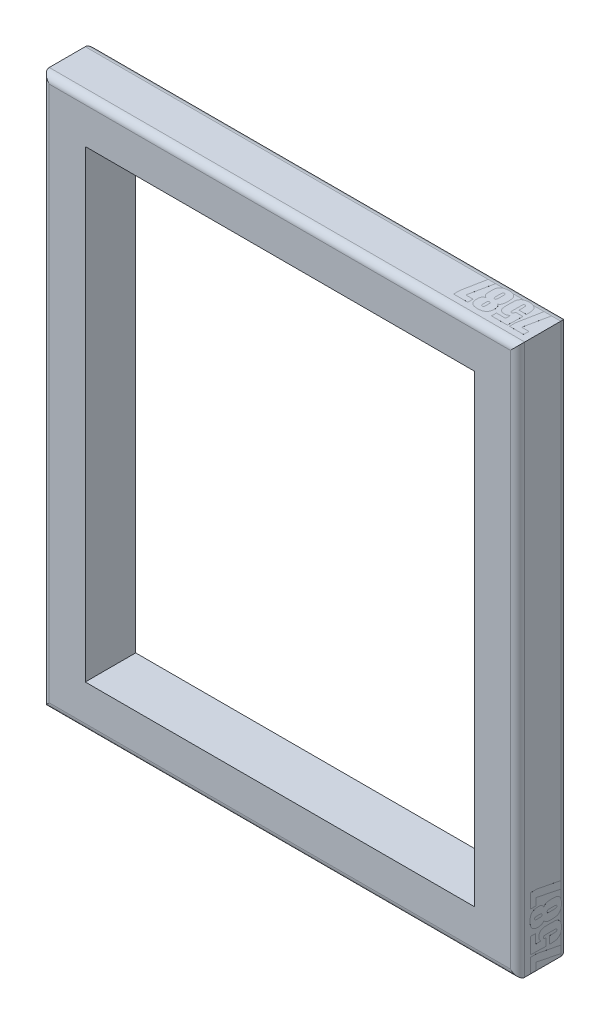
from build123d import *

# Parameters (mm, degrees)
SKETCH1_W           = 838.2
SKETCH1_H           = 969.899
SKETCH1_W_2         = 685.8
SKETCH1_H_2         = 817.499
BOSS_EXTRUDE1_DEPTH = 88.9
FILLET1_R           = 12.7
BOSS_EXTRUDE4_DEPTH = 0.0254
BOSS_EXTRUDE6_DEPTH = 0.0254
BOSS_EXTRUDE7_DEPTH = 0.0254
BOSS_EXTRUDE8_DEPTH = 0.0254


with BuildPart() as part:
    # Sketch1 → Boss-Extrude1 (new body)
    with BuildSketch(Plane.XY):
        with Locations((-393.7, 408.7495)):
            Rectangle(SKETCH1_W, SKETCH1_H)
        with Locations((-393.7, 408.7495)):
            Rectangle(SKETCH1_W_2, SKETCH1_H_2, mode=Mode.SUBTRACT)
    extrude(amount=-BOSS_EXTRUDE1_DEPTH)

    # Fillet1
    fillet1_edges = [part.edges().sort_by_distance(p)[0] for p in [
        (-812.8, 408.7495, -88.9),
        (-393.7, -76.2, -88.9),
        (25.4, 408.7495, -88.9),
        (-393.7, -76.2, 0),
        (-812.8, 408.7495, 0),
        (-393.7, 893.699, 0),
        (25.4, 408.7495, 0),
        (-393.7, 893.699, -88.9),
    ]]
    fillet(fillet1_edges, radius=FILLET1_R)

    # Sketch6 → Boss-Extrude4 (add)
    # profile 1 of 4: a face of its own
    with BuildSketch(Plane.XZ.offset(76.2)):
        Polygon((-775.397206265, -23.212708876), (-775.397206265, -34.277702022), (-783.501144908, -76.2), (-796.592122715, -76.2), (-787.553114229, -32.56340731), (-800.332402089, -32.56340731), (-800.332402089, -23.212708876), align=None)
    # profile 2 of 4: a face of its own
    with BuildSketch(Plane.XZ.offset(76.2)):
        with BuildLine():
            Line((-743.604831591, -23.212708876), (-743.604831591, -31.940027414))
            Line((-743.604831591, -31.940027414), (-759.812708876, -31.940027414))
            Line((-759.812708876, -31.940027414), (-759.812708876, -41.20306305))
            add(Edge.make_bspline(
                [(-759.812708876, -41.20306305), (-759.555977375, -40.911161607), (-759.05289104, -40.339156897), (-758.203287973, -39.59948061), (-757.31688462, -38.950610996), (-756.352540612, -38.449686845), (-755.344439189, -38.047478435), (-754.284990342, -37.748811018), (-753.165177285, -37.585699612), (-752.40083068, -37.562359109), (-752.01071987, -37.550446474)],
                knots=[0, 0, 0, 0, 1.045137506, 2.048032268, 3.025244095, 3.994689253, 4.963425262, 5.942900511, 6.950087905, 8, 8, 8, 8], degree=3))
            add(Edge.make_bspline(
                [(-752.01071987, -37.550446474), (-751.5753946, -37.560572296), (-750.728501027, -37.580271344), (-749.497473757, -37.710161958), (-748.352134752, -37.959944885), (-747.283944753, -38.283288733), (-746.304722065, -38.719671226), (-745.395639036, -39.230451526), (-744.588349742, -39.866074338), (-743.836345836, -40.580764758), (-743.183903273, -41.452215936), (-742.617057693, -42.483166997), (-742.159128138, -43.696673794), (-741.77022763, -45.074712041), (-741.473512713, -46.629495222), (-741.268166909, -48.357810092), (-741.125354909, -50.259181789), (-741.116125032, -51.5859422), (-741.111312009, -52.277796507)],
                knots=[0, 0, 0, 0, 0.985872992, 1.917944025, 2.797562931, 3.637028488, 4.440265023, 5.220874469, 5.991447987, 6.760933446, 7.563799771, 8.445720104, 9.41645382, 10.49401341, 11.685015475, 12.996358654, 14.433717056, 16, 16, 16, 16], degree=3))
            Line((-741.111312009, -52.277796507), (-741.111312009, -59.787576187))
            add(Edge.make_bspline(
                [(-741.111312009, -59.787576187), (-741.114314059, -60.238869043), (-741.120102449, -61.109027139), (-741.132437229, -62.369251199), (-741.18586531, -63.534721041), (-741.245170034, -64.609302477), (-741.304170666, -65.591480595), (-741.408615106, -66.480132886), (-741.509134218, -67.277361296), (-741.677117644, -68.21229513), (-741.961013415, -69.299467562), (-742.455270802, -70.542019338), (-743.103274578, -71.734601638), (-743.897310805, -72.873428682), (-744.855086628, -73.928491163), (-745.99965081, -74.845926401), (-747.309829524, -75.63960778), (-748.787634854, -76.301622987), (-750.439137733, -76.816037958), (-752.260627054, -77.179374827), (-754.251892978, -77.404169059), (-755.636736722, -77.432215352), (-756.354898518, -77.446759791)],
                knots=[0, 0, 0, 0, 0.989754807, 1.908390848, 2.7635747, 3.547977914, 4.268858805, 4.920711554, 5.509810583, 6.030765573, 7.003130656, 7.968352344, 8.956004724, 9.973318671, 11.006457242, 12.069562088, 13.178372901, 14.357538766, 15.611873537, 16.963616047, 18.425371121, 20, 20, 20, 20], degree=3))
            add(Edge.make_bspline(
                [(-756.354898518, -77.446759791), (-757.167673364, -77.423696733), (-758.751523705, -77.378753864), (-761.05612293, -77.047243869), (-763.212671595, -76.481238427), (-764.895167638, -75.823258393), (-766.14184118, -75.184766025), (-767.002125828, -74.651314239), (-767.786123641, -74.048742685), (-768.508077965, -73.401879218), (-769.151305518, -72.690376618), (-769.747123523, -71.942274062), (-770.247032282, -71.118609389), (-770.694605848, -70.238104289), (-771.081180372, -69.268096101), (-771.39116018, -68.181756329), (-771.680128414, -66.981343604), (-771.89630434, -65.652363449), (-772.069495514, -64.202944467), (-772.19718483, -62.633737406), (-772.259396094, -60.943929123), (-772.273171852, -59.777875526), (-772.280306787, -59.173936602)],
                knots=[0, 0, 0, 0, 1.727950145, 3.367247941, 4.937991842, 6.459754912, 7.197724692, 7.914163588, 8.608713051, 9.29788901, 9.972208411, 10.646138941, 11.328189198, 12.016707826, 12.744892405, 13.544369189, 14.416825977, 15.369082158, 16.405235107, 17.52037283, 18.715716525, 20, 20, 20, 20], degree=3))
            Line((-772.280306787, -59.173936602), (-772.280306787, -56.251843342))
            Line((-772.280306787, -56.251843342), (-759.18932898, -56.251843342))
            Line((-759.18932898, -56.251843342), (-759.18932898, -59.641471524))
            add(Edge.make_bspline(
                [(-759.18932898, -59.641471524), (-759.185620671, -60.063543871), (-759.178460766, -60.878469966), (-759.175578588, -62.05402751), (-759.143093775, -63.135195908), (-759.105722103, -64.1191072), (-759.057462951, -65.005613589), (-759.000320479, -65.798151324), (-758.931134266, -66.496217071), (-758.862522052, -67.107009795), (-758.747097607, -67.634534221), (-758.58241763, -68.088113051), (-758.368492845, -68.478355815), (-758.090365421, -68.79894568), (-757.75425622, -69.040832504), (-757.374015527, -69.226510605), (-756.933682995, -69.317704752), (-756.624701065, -69.334159029), (-756.462041937, -69.342821149)],
                knots=[0, 0, 0, 0, 1.823732709, 3.521214749, 5.07892445, 6.496893277, 7.775393918, 8.9147992, 9.929598955, 10.806563962, 11.568882902, 12.256841855, 12.884990135, 13.481481553, 14.073502327, 14.663358483, 15.296344146, 16, 16, 16, 16], degree=3))
            add(Edge.make_bspline(
                [(-756.462041937, -69.342821149), (-756.311814224, -69.335904639), (-756.019469637, -69.322445045), (-755.609150798, -69.202677213), (-755.238890611, -69.013447494), (-754.844055704, -68.652305625), (-754.463702156, -68.127802624), (-754.304731396, -67.549210427), (-754.301321899, -67.089367955), (-754.273196809, -66.687313598), (-754.270968077, -66.134958148), (-754.261914861, -65.433646231), (-754.235937401, -64.583189124), (-754.235071306, -63.582957594), (-754.2071631, -62.437042159), (-754.203977638, -61.622021218), (-754.202289816, -61.190180952)],
                knots=[0, 0, 0, 0, 0.670460052, 1.304721758, 1.895793995, 2.513210904, 3.681360763, 4.748587252, 5.126397419, 5.736946296, 6.550219692, 7.595791071, 8.873918375, 10.355072828, 12.068728984, 14, 14, 14, 14], degree=3))
            Line((-754.202289816, -61.190180952), (-754.202289816, -50.758308012))
            add(Edge.make_bspline(
                [(-754.202289816, -50.758308012), (-754.209495191, -50.303588843), (-754.222695071, -49.470566535), (-754.319979118, -48.338076136), (-754.493400248, -47.438533211), (-754.749555135, -46.745585738), (-755.122962603, -46.249037086), (-755.575763802, -45.884057111), (-756.149429362, -45.690937481), (-756.558153995, -45.667007013), (-756.773731885, -45.654385117)],
                knots=[0, 0, 0, 0, 1.685864163, 3.088417099, 4.207402662, 5.076902269, 5.799120759, 6.485333904, 7.201103886, 8, 8, 8, 8], degree=3))
            add(Edge.make_bspline(
                [(-756.773731885, -45.654385117), (-756.913880725, -45.659095977), (-757.188087064, -45.668312949), (-757.582646896, -45.7669057), (-757.939269015, -45.938230081), (-758.352480278, -46.22605672), (-758.7466933, -46.66636358), (-759.030906314, -47.194645083), (-759.101551428, -47.734734037), (-759.164457035, -48.321253834), (-759.18302364, -49.105777274), (-759.187085498, -49.693453639), (-759.18932898, -50.018044386)],
                knots=[0, 0, 0, 0, 0.735055358, 1.438162732, 2.117072139, 2.803012647, 4.070557493, 5.191645157, 5.884125613, 6.912400264, 8.294628872, 10, 10, 10, 10], degree=3))
            Line((-759.18932898, -50.018044386), (-772.280306787, -50.018044386))
            Line((-772.280306787, -50.018044386), (-771.656926892, -23.212708876))
            Line((-771.656926892, -23.212708876), (-743.604831591, -23.212708876))
        make_face()
    # profile 3 of 4: a face of its own
    with BuildSketch(Plane.XZ.offset(76.2)):
        with BuildLine():
            add(Edge.make_bspline(
                [(-710.692321167, -46.58945496), (-710.253487376, -46.794102682), (-709.389538795, -47.197000345), (-708.235364294, -48.012376105), (-707.249912338, -48.978472514), (-706.523152283, -49.897517746), (-706.051202939, -50.811292425), (-705.762743279, -51.706861748), (-705.51589336, -52.796404663), (-705.301551238, -54.080522928), (-705.156204486, -55.567900372), (-705.041655919, -57.253698057), (-704.959553092, -59.140684774), (-704.956748525, -60.466056129), (-704.955278065, -61.160960019)],
                knots=[0, 0, 0, 0, 1.032863208, 2.033436625, 2.999672589, 3.9748283, 4.520758756, 5.187511175, 5.978195588, 6.906317789, 7.966347498, 9.169082625, 10.515725053, 12, 12, 12, 12], degree=3))
            add(Edge.make_bspline(
                [(-704.955278065, -61.160960019), (-704.958814763, -61.674005032), (-704.965666773, -62.667980084), (-705.023698386, -64.103820002), (-705.120085308, -65.435815896), (-705.253802708, -66.66448171), (-705.42938603, -67.788315856), (-705.628046142, -68.812038252), (-705.879907395, -69.726796939), (-706.176510337, -70.550492599), (-706.518720915, -71.309018255), (-706.946029104, -72.011170672), (-707.430230635, -72.689024305), (-708.003004831, -73.320562442), (-708.638355668, -73.929374639), (-709.349659441, -74.501289288), (-710.133300581, -75.04017453), (-710.989805449, -75.534912741), (-711.923071811, -75.986497091), (-712.931173784, -76.384062017), (-714.015916849, -76.715170959), (-715.176538596, -76.974211096), (-716.408193527, -77.188055959), (-717.718139511, -77.344956513), (-719.103536316, -77.430364051), (-720.052646646, -77.441198853), (-720.539775455, -77.446759791)],
                knots=[0, 0, 0, 0, 1.398583789, 2.709620715, 3.916618244, 5.038718275, 6.077731848, 7.016823425, 7.880065367, 8.661220812, 9.401808779, 10.144087346, 10.898301765, 11.669363034, 12.464435054, 13.295212249, 14.15449737, 15.054744736, 15.988985256, 16.978448116, 18.005975078, 19.077395418, 20.218224661, 21.412695174, 22.672071436, 24, 24, 24, 24], degree=3))
            add(Edge.make_bspline(
                [(-720.539775455, -77.446759791), (-721.013954922, -77.441503254), (-721.93718878, -77.431268704), (-723.28284111, -77.341861974), (-724.551441867, -77.199808417), (-725.743148784, -76.99043543), (-726.866555879, -76.747615488), (-727.907622999, -76.419394986), (-728.880842673, -76.05687962), (-729.769055527, -75.612817835), (-730.586703699, -75.12200953), (-731.351457247, -74.606583761), (-732.058624654, -74.050674339), (-732.694411171, -73.448412652), (-733.280015525, -72.816393903), (-733.80680854, -72.148745446), (-734.260650581, -71.432964934), (-734.677334577, -70.678366318), (-735.017688554, -69.829695849), (-735.31940769, -68.873086589), (-735.569168259, -67.788127109), (-735.767979966, -66.577220491), (-735.935428241, -65.238877596), (-736.047194349, -63.772964785), (-736.116516416, -62.181130169), (-736.121622822, -61.079869578), (-736.124272844, -60.508359191)],
                knots=[0, 0, 0, 0, 1.268974087, 2.470709768, 3.607874871, 4.683617739, 5.708163252, 6.681184595, 7.602668945, 8.484841014, 9.334307608, 10.153776327, 10.951769698, 11.738661753, 12.495071084, 13.256455536, 14.010915677, 14.761311323, 15.560108623, 16.453296839, 17.443968622, 18.536843119, 19.736471951, 21.052764021, 22.470501904, 24, 24, 24, 24], degree=3))
            add(Edge.make_bspline(
                [(-736.124272844, -60.508359191), (-736.11912778, -59.738645817), (-736.109176065, -58.249846521), (-735.967151758, -56.095256859), (-735.754514227, -54.09961998), (-735.520886163, -52.531610578), (-735.226436538, -51.36034273), (-734.912756596, -50.540142343), (-734.512646973, -49.762291945), (-734.008144846, -49.035614416), (-733.409580802, -48.353894585), (-732.725947764, -47.710146664), (-731.952178901, -47.108489834), (-731.381373835, -46.765447118), (-731.088532125, -46.58945496)],
                knots=[0, 0, 0, 0, 1.76788096, 3.419480574, 4.957221844, 6.378326448, 7.056708483, 7.727130868, 8.390966019, 9.061263932, 9.753766915, 10.471320765, 11.215737443, 12, 12, 12, 12], degree=3))
            add(Edge.make_bspline(
                [(-731.088532125, -46.58945496), (-731.49093332, -46.373423135), (-732.290000875, -45.944438271), (-733.320895239, -45.042456456), (-734.198533639, -43.976346239), (-734.918397885, -42.730124608), (-735.453741877, -41.298912841), (-735.855258326, -39.699046673), (-736.082931276, -37.920597805), (-736.110123233, -36.677708203), (-736.124272844, -36.030957979)],
                knots=[0, 0, 0, 0, 0.883452064, 1.754313577, 2.635585967, 3.552582121, 4.531408869, 5.589827807, 6.745842426, 8, 8, 8, 8], degree=3))
            add(Edge.make_bspline(
                [(-736.124272844, -36.030957979), (-736.11485617, -35.462195026), (-736.096614336, -34.360396344), (-735.904533962, -32.761034378), (-735.608268676, -31.270623142), (-735.194430392, -29.885805214), (-734.639828046, -28.619081076), (-733.983074979, -27.450393201), (-733.183446758, -26.402041154), (-732.27111657, -25.456629554), (-731.233035533, -24.626176928), (-730.072238941, -23.913095828), (-728.79773282, -23.309201617), (-727.405857517, -22.809058021), (-725.890159765, -22.436201844), (-724.258687175, -22.166298974), (-722.507538248, -21.998721399), (-721.299906789, -21.977111204), (-720.676139807, -21.965949085)],
                knots=[0, 0, 0, 0, 1.139402086, 2.207231867, 3.22303984, 4.18224988, 5.097340406, 5.98918555, 6.862439802, 7.732171629, 8.616292135, 9.519178424, 10.456373729, 11.438161639, 12.478190297, 13.58003508, 14.750037352, 16, 16, 16, 16], degree=3))
            add(Edge.make_bspline(
                [(-720.676139807, -21.965949085), (-719.961453663, -21.976152166), (-718.588200433, -21.995757157), (-716.612677728, -22.17235312), (-714.807341552, -22.457355795), (-713.172230372, -22.86237432), (-711.709311377, -23.384193826), (-710.419058513, -24.029851148), (-709.293602942, -24.788153544), (-708.345979101, -25.683184673), (-707.543951702, -26.681096088), (-706.847406171, -27.768477757), (-706.262700087, -28.959641298), (-705.773231955, -30.245907568), (-705.406660699, -31.637792434), (-705.150145582, -33.124115808), (-704.975290585, -34.708627918), (-704.962082349, -35.79993614), (-704.955278065, -36.362128548)],
                knots=[0, 0, 0, 0, 1.390282688, 2.671396681, 3.855329736, 4.943140366, 5.94429892, 6.870936351, 7.743522199, 8.574793464, 9.396625976, 10.229000645, 11.082185822, 11.973862168, 12.902457006, 13.877689888, 14.906682267, 16, 16, 16, 16], degree=3))
            add(Edge.make_bspline(
                [(-704.955278065, -36.362128548), (-704.959749129, -36.716069238), (-704.968408444, -37.401562372), (-705.013729812, -38.389707737), (-705.100472887, -39.303374453), (-705.226410501, -40.135369978), (-705.380348808, -40.894415369), (-705.571590454, -41.576659915), (-705.805898379, -42.181958593), (-706.165520964, -42.913806345), (-706.810610016, -43.768744031), (-707.8379621, -44.731094828), (-709.147119296, -45.699111995), (-710.15307968, -46.278744837), (-710.692321167, -46.58945496)],
                knots=[0, 0, 0, 0, 1.011071591, 1.958188627, 2.824730267, 3.631383318, 4.36076049, 5.035941548, 5.65252725, 6.212453826, 7.360711157, 8.68567436, 10.223367527, 12, 12, 12, 12], degree=3))
        make_face()
        with BuildLine():
            add(Edge.make_bspline(
                [(-718.046255872, -34.638093525), (-718.050069251, -34.215848653), (-718.057034173, -33.444642203), (-718.146684482, -32.403735528), (-718.299876045, -31.592436044), (-718.527019522, -30.98155937), (-718.879626957, -30.551996084), (-719.341464355, -30.259006447), (-719.925930979, -30.099881266), (-720.350504889, -30.080373971), (-720.578736698, -30.069887727)],
                knots=[0, 0, 0, 0, 1.677591877, 3.064026972, 4.144413779, 4.954209473, 5.623204291, 6.313866106, 7.09361037, 8, 8, 8, 8], degree=3))
            add(Edge.make_bspline(
                [(-720.578736698, -30.069887727), (-720.80114805, -30.07813553), (-721.216228387, -30.093528182), (-721.782430055, -30.282381675), (-722.235617987, -30.593032725), (-722.56830823, -31.052628019), (-722.786265025, -31.675067746), (-722.927193684, -32.479940593), (-723.024100019, -33.489713219), (-723.030043198, -34.231966187), (-723.033295037, -34.638093525)],
                knots=[0, 0, 0, 0, 0.893586732, 1.667676933, 2.372236962, 3.073872481, 3.915008431, 5.008641075, 6.36326335, 8, 8, 8, 8], degree=3))
            Line((-723.033295037, -34.638093525), (-723.033295037, -38.797206265))
            add(Edge.make_bspline(
                [(-723.033295037, -38.797206265), (-723.026423869, -39.177380053), (-723.013764603, -39.877802598), (-722.911013987, -40.83397162), (-722.749541266, -41.605461104), (-722.498782367, -42.206501342), (-722.133817264, -42.642542693), (-721.680139916, -42.959242866), (-721.116208396, -43.131031073), (-720.712937232, -43.150581758), (-720.500814211, -43.160865534)],
                knots=[0, 0, 0, 0, 1.580112676, 2.911159526, 3.99162225, 4.849527291, 5.587451052, 6.3250044, 7.118942395, 8, 8, 8, 8], degree=3))
            add(Edge.make_bspline(
                [(-720.500814211, -43.160865534), (-720.27848227, -43.151914515), (-719.86457175, -43.135250598), (-719.301851642, -42.956797327), (-718.842259039, -42.668595802), (-718.506805208, -42.212621467), (-718.290798872, -41.575176113), (-718.15070244, -40.727966927), (-718.055128914, -39.640204651), (-718.049409829, -38.83317384), (-718.046255872, -38.388113209)],
                knots=[0, 0, 0, 0, 0.861738235, 1.604279261, 2.26950699, 2.936050938, 3.759007418, 4.863263716, 6.270155474, 8, 8, 8, 8], degree=3))
            Line((-718.046255872, -38.388113209), (-718.046255872, -34.638093525))
        make_face(mode=Mode.SUBTRACT)
        with BuildLine():
            add(Edge.make_bspline(
                [(-718.046255872, -56.972626346), (-718.051650062, -56.504657885), (-718.061485576, -55.651386075), (-718.177335018, -54.501977875), (-718.338998371, -53.596117351), (-718.615462257, -52.922809224), (-718.983107683, -52.439210606), (-719.447128036, -52.115529202), (-719.997645124, -51.911559219), (-720.398259773, -51.896215562), (-720.607957631, -51.888184072)],
                knots=[0, 0, 0, 0, 1.738659472, 3.170190386, 4.292187352, 5.146388336, 5.851388248, 6.517831636, 7.224173325, 8, 8, 8, 8], degree=3))
            add(Edge.make_bspline(
                [(-720.607957631, -51.888184072), (-720.811070464, -51.896599966), (-721.194708044, -51.912495824), (-721.723050165, -52.107330947), (-722.161231547, -52.420202549), (-722.517823672, -52.884607234), (-722.752612253, -53.557212561), (-722.915515993, -54.458975986), (-723.013843501, -55.6264714), (-723.026395973, -56.495172595), (-723.033295037, -56.972626346)],
                knots=[0, 0, 0, 0, 0.760444209, 1.436319754, 2.083469305, 2.762315263, 3.601134717, 4.733605304, 6.204730916, 8, 8, 8, 8], degree=3))
            Line((-723.033295037, -56.972626346), (-723.033295037, -63.897987373))
            add(Edge.make_bspline(
                [(-723.033295037, -63.897987373), (-723.031638696, -64.173996507), (-723.028480872, -64.700209827), (-722.999229458, -65.450525857), (-722.953024741, -66.123390099), (-722.883160131, -66.720891139), (-722.805771588, -67.244546297), (-722.680622548, -67.686884709), (-722.565238426, -68.057860706), (-722.370496587, -68.435558786), (-722.058250663, -68.805624502), (-721.589496558, -69.123064419), (-721.028223384, -69.318121442), (-720.625873758, -69.334278767), (-720.413151413, -69.342821149)],
                knots=[0, 0, 0, 0, 1.447752538, 2.760150215, 3.93838463, 4.984106116, 5.916477053, 6.709663222, 7.393673362, 7.949736311, 8.928845415, 9.89723076, 10.888265397, 12, 12, 12, 12], degree=3))
            add(Edge.make_bspline(
                [(-720.413151413, -69.342821149), (-720.196938553, -69.335561668), (-719.792855614, -69.321994332), (-719.245293342, -69.119990806), (-718.80984112, -68.794225036), (-718.55158479, -68.410738316), (-718.402688259, -68.027964827), (-718.307504809, -67.654896532), (-718.237181156, -67.200599882), (-718.151354006, -66.673174845), (-718.112979108, -66.063790055), (-718.068679633, -65.379113387), (-718.054554773, -64.615555538), (-718.049099094, -64.079795235), (-718.046255872, -63.800584265)],
                knots=[0, 0, 0, 0, 1.132013677, 2.115634625, 3.017552291, 3.950947162, 4.502860332, 5.17404829, 5.971581461, 6.920938255, 7.983416076, 9.181056498, 10.530910287, 12, 12, 12, 12], degree=3))
            Line((-718.046255872, -63.800584265), (-718.046255872, -56.972626346))
        make_face(mode=Mode.SUBTRACT)
    # profile 4 of 4: a face of its own
    with BuildSketch(Plane.XZ.offset(76.2)):
        Polygon((-676.903182764, -23.212708876), (-676.903182764, -34.277702022), (-685.007121407, -76.2), (-698.098099214, -76.2), (-689.059090728, -32.56340731), (-701.838378587, -32.56340731), (-701.838378587, -23.212708876), align=None)
    extrude(amount=BOSS_EXTRUDE4_DEPTH)

    # Sketch9 → Boss-Extrude6 (add)
    # profile 1 of 4: a face of its own
    with BuildSketch(Plane(origin=(0, 893.699, 0), x_dir=(1, 0, 0), z_dir=(0, 1, 0))):
        Polygon((-12.002793735, 23.212708876), (-12.002793735, 34.277702022), (-3.898855092, 76.2), (9.192122715, 76.2), (0.153114229, 32.56340731), (12.932402088, 32.56340731), (12.932402088, 23.212708876), align=None)
    # profile 2 of 4: a face of its own
    with BuildSketch(Plane(origin=(0, 893.699, 0), x_dir=(1, 0, 0), z_dir=(0, 1, 0))):
        with BuildLine():
            Line((-43.795168409, 23.212708876), (-43.795168409, 31.940027414))
            Line((-43.795168409, 31.940027414), (-27.587291124, 31.940027414))
            Line((-27.587291124, 31.940027414), (-27.587291124, 41.20306305))
            add(Edge.make_bspline(
                [(-27.587291124, 41.20306305), (-27.844022625, 40.911161607), (-28.34710896, 40.339156897), (-29.196712027, 39.59948061), (-30.08311538, 38.950610996), (-31.047459388, 38.449686845), (-32.055560811, 38.047478435), (-33.115009658, 37.748811018), (-34.234822715, 37.585699612), (-34.999169321, 37.562359109), (-35.38928013, 37.550446474)],
                knots=[0, 0, 0, 0, 1.045137506, 2.048032268, 3.025244095, 3.994689253, 4.963425262, 5.942900511, 6.950087905, 8, 8, 8, 8], degree=3))
            add(Edge.make_bspline(
                [(-35.38928013, 37.550446474), (-35.82483169, 37.558999433), (-36.672536833, 37.575645882), (-37.900162584, 37.727141616), (-39.046945917, 37.953623248), (-40.110326501, 38.289704751), (-41.096867021, 38.713866841), (-41.997936743, 39.24351223), (-42.815295168, 39.864324093), (-43.563033929, 40.581638), (-44.216283888, 41.451952428), (-44.782884534, 42.483248337), (-45.240889881, 43.696648425), (-45.629766757, 45.074719943), (-45.926489025, 46.629492776), (-46.131832559, 48.357810842), (-46.274645244, 50.259181574), (-46.28387502, 51.585942126), (-46.288687991, 52.277796507)],
                knots=[0, 0, 0, 0, 0.985978896, 1.918990669, 2.797197047, 3.629736286, 4.43979477, 5.224184376, 5.990372855, 6.759940973, 7.562893544, 8.444908613, 9.415746607, 10.49342195, 11.684551954, 12.996035999, 14.433548803, 16, 16, 16, 16], degree=3))
            Line((-46.288687991, 52.277796507), (-46.288687991, 59.787576187))
            add(Edge.make_bspline(
                [(-46.288687991, 59.787576187), (-46.285674889, 60.238867878), (-46.27986519, 61.109023726), (-46.267678049, 62.369263354), (-46.213748527, 63.534680324), (-46.156098087, 64.609436191), (-46.091704033, 65.590706865), (-46.005086221, 66.477663458), (-45.899034525, 67.270684447), (-45.732977393, 68.202549632), (-45.448818232, 69.294295949), (-44.947273209, 70.535574688), (-44.294645712, 71.727063054), (-43.499752728, 72.864172872), (-42.548464878, 73.928509909), (-41.399885995, 74.845548167), (-40.090265158, 75.639504169), (-38.612502594, 76.302530694), (-36.95951084, 76.812349409), (-35.141491071, 77.195841231), (-33.147140134, 77.399548484), (-31.763054635, 77.430634728), (-31.045101482, 77.446759791)],
                knots=[0, 0, 0, 0, 0.98969914, 1.908283515, 2.763419269, 3.547778367, 4.268618713, 4.919695537, 5.50170546, 6.022631151, 6.994941545, 7.969361217, 8.950701588, 9.967958318, 11.006300459, 12.069345513, 13.178093963, 14.357193509, 15.611457733, 16.964567375, 18.425459682, 20, 20, 20, 20], degree=3))
            add(Edge.make_bspline(
                [(-31.045101482, 77.446759791), (-30.232462421, 77.423078257), (-28.645663182, 77.376836523), (-26.338309487, 77.053246545), (-24.186168949, 76.466634058), (-22.504999025, 75.813624192), (-21.257690876, 75.175579205), (-20.401322593, 74.640294678), (-19.610519844, 74.049843494), (-18.892994364, 73.400801245), (-18.247653382, 72.69375941), (-17.663761791, 71.938839689), (-17.162337767, 71.119018468), (-16.714383307, 70.238230093), (-16.331989911, 69.266179999), (-16.001871157, 68.185286601), (-15.737328991, 66.978345715), (-15.498471204, 65.653936181), (-15.332091737, 64.202637299), (-15.202344852, 62.633828423), (-15.140735394, 60.943903677), (-15.126873013, 59.777866844), (-15.119693213, 59.173936602)],
                knots=[0, 0, 0, 0, 1.728367873, 3.374896622, 4.941126004, 6.463256957, 7.201405138, 7.918017232, 8.608569322, 9.297911888, 9.972394304, 10.642265426, 11.324480566, 12.013165642, 12.741526258, 13.543191508, 14.414300458, 15.367962646, 16.404366083, 17.519773387, 18.715406053, 20, 20, 20, 20], degree=3))
            Line((-15.119693213, 59.173936602), (-15.119693213, 56.251843342))
            Line((-15.119693213, 56.251843342), (-28.21067102, 56.251843342))
            Line((-28.21067102, 56.251843342), (-28.21067102, 59.641471524))
            add(Edge.make_bspline(
                [(-28.21067102, 59.641471524), (-28.214383136, 60.063543486), (-28.221550391, 60.878468837), (-28.224381763, 62.054031522), (-28.25703653, 63.135182722), (-28.29385659, 64.119149833), (-28.34387873, 65.005477822), (-28.395273856, 65.795692915), (-28.481188195, 66.489160407), (-28.549592892, 67.09618337), (-28.653358095, 67.627891496), (-28.81286369, 68.089381726), (-29.043808817, 68.47195165), (-29.308553864, 68.80243365), (-29.646493592, 69.040233336), (-30.025769186, 69.226682639), (-30.46637965, 69.317654693), (-30.77532054, 69.334141765), (-30.937958063, 69.342821149)],
                knots=[0, 0, 0, 0, 1.824236655, 3.522187753, 5.080327891, 6.49868854, 7.777542464, 8.917262594, 9.919851397, 10.797058732, 11.556612963, 12.257940989, 12.893274711, 13.48078562, 14.072969985, 14.662989134, 15.296149708, 16, 16, 16, 16], degree=3))
            add(Edge.make_bspline(
                [(-30.937958063, 69.342821149), (-31.08812485, 69.335800998), (-31.380350872, 69.322139717), (-31.79576465, 69.202563038), (-32.166449741, 69.004930161), (-32.566111281, 68.645593198), (-32.934303118, 68.114351447), (-33.095548843, 67.539623534), (-33.098481212, 67.082828558), (-33.127366707, 66.680859635), (-33.128714438, 66.131696816), (-33.138309415, 65.430406488), (-33.164019843, 64.583187234), (-33.16494287, 63.58295822), (-33.192832585, 62.437041969), (-33.196020867, 61.622021152), (-33.197710184, 61.190180952)],
                knots=[0, 0, 0, 0, 0.670608384, 1.305010414, 1.915867048, 2.533420554, 3.693585531, 4.761048132, 5.138941885, 5.735119042, 6.563093728, 7.594374212, 8.872784286, 10.354266428, 12.068301712, 14, 14, 14, 14], degree=3))
            Line((-33.197710184, 61.190180952), (-33.197710184, 50.758308012))
            add(Edge.make_bspline(
                [(-33.197710184, 50.758308012), (-33.190813055, 50.303529465), (-33.178226891, 49.473630846), (-33.077813028, 48.341847455), (-32.908426475, 47.441037791), (-32.649618058, 46.746707725), (-32.280477577, 46.247329875), (-31.818669162, 45.897557313), (-31.25336298, 45.687163837), (-30.842423642, 45.665683729), (-30.626268115, 45.654385117)],
                knots=[0, 0, 0, 0, 1.686577367, 3.07773583, 4.208985325, 5.078852773, 5.801376797, 6.48055365, 7.200765913, 8, 8, 8, 8], degree=3))
            add(Edge.make_bspline(
                [(-30.626268115, 45.654385117), (-30.48608188, 45.659048286), (-30.211802376, 45.668171948), (-29.817767019, 45.76743358), (-29.461642971, 45.935178652), (-29.057477955, 46.233622598), (-28.65096982, 46.657195191), (-28.382111104, 47.19426346), (-28.294745175, 47.730043727), (-28.237275226, 48.321647914), (-28.21635891, 49.105636808), (-28.212694809, 49.69340366), (-28.21067102, 50.018044386)],
                knots=[0, 0, 0, 0, 0.735446102, 1.438927237, 2.118197541, 2.790575895, 4.070333913, 5.169206575, 5.881937678, 6.910758944, 8.293722323, 10, 10, 10, 10], degree=3))
            Line((-28.21067102, 50.018044386), (-15.119693213, 50.018044386))
            Line((-15.119693213, 50.018044386), (-15.743073108, 23.212708876))
            Line((-15.743073108, 23.212708876), (-43.795168409, 23.212708876))
        make_face()
    # profile 3 of 4: a face of its own
    with BuildSketch(Plane(origin=(0, 893.699, 0), x_dir=(1, 0, 0), z_dir=(0, 1, 0))):
        with BuildLine():
            add(Edge.make_bspline(
                [(-76.707678834, 46.58945496), (-77.147089048, 46.793342558), (-78.009762489, 47.193625505), (-79.155828591, 48.018994395), (-80.15059666, 48.974477537), (-80.87657345, 49.89781767), (-81.34886596, 50.811217082), (-81.63723271, 51.706888006), (-81.884114831, 52.796395706), (-82.098446061, 54.080525882), (-82.243796389, 55.567899415), (-82.358343803, 57.253698361), (-82.440446989, 59.140684685), (-82.443251503, 60.466056098), (-82.444721935, 61.160960019)],
                knots=[0, 0, 0, 0, 1.032921266, 2.027885824, 2.999166675, 3.9743772, 4.520338343, 5.187128241, 5.977857099, 6.90603147, 7.966120764, 9.168923498, 10.515641621, 12, 12, 12, 12], degree=3))
            add(Edge.make_bspline(
                [(-82.444721935, 61.160960019), (-82.441222464, 61.674011343), (-82.434442577, 62.667998621), (-82.375909289, 64.103753497), (-82.281219333, 65.436037053), (-82.142250903, 66.660068861), (-81.985526826, 67.787231478), (-81.768018511, 68.803110881), (-81.531386044, 69.721520111), (-81.232708265, 70.540718455), (-80.890506351, 71.298797536), (-80.465318568, 72.005058792), (-79.965536003, 72.676614485), (-79.400760935, 73.320390073), (-78.76413912, 73.929550059), (-78.046973191, 74.490420647), (-77.267563789, 75.031890858), (-76.407194542, 75.522260004), (-75.481935998, 75.991269993), (-74.466198776, 76.371379158), (-73.383108595, 76.703594269), (-72.22489048, 76.97736141), (-70.99160367, 77.187110482), (-69.681918864, 77.345228662), (-68.296447821, 77.430290097), (-67.347347974, 77.44117377), (-66.860224546, 77.446759791)],
                knots=[0, 0, 0, 0, 1.398670318, 2.709788357, 3.916860561, 5.039030015, 6.068030165, 7.017633598, 7.870060263, 8.651264037, 9.391897823, 10.134222314, 10.893711138, 11.671447011, 12.466568221, 13.291861523, 14.151199807, 15.051502871, 15.989692636, 16.976004672, 18.003595206, 19.077090862, 20.217990687, 21.4125351, 22.671989278, 24, 24, 24, 24], degree=3))
            add(Edge.make_bspline(
                [(-66.860224546, 77.446759791), (-66.38605933, 77.441440315), (-65.462853222, 77.431083223), (-64.117004727, 77.342542768), (-62.845910015, 77.197094527), (-61.651109246, 76.997805113), (-60.534316697, 76.729077333), (-59.488101584, 76.425779607), (-58.5210689, 76.04465469), (-57.634108536, 75.6014242), (-56.807384617, 75.124773777), (-56.051407505, 74.595625904), (-55.344655999, 74.040875162), (-54.69971851, 73.447874403), (-54.122189891, 72.81003024), (-53.607247907, 72.137059098), (-53.14199842, 71.430605924), (-52.737996467, 70.667703651), (-52.378621502, 69.822961986), (-52.081745122, 68.862798154), (-51.831718763, 67.781594079), (-51.630115898, 66.570974697), (-51.46614036, 65.235462509), (-51.352104854, 63.769783394), (-51.283641592, 62.18111528), (-51.278431162, 61.079864491), (-51.275727156, 60.508359191)],
                knots=[0, 0, 0, 0, 1.269319951, 2.471383168, 3.608858211, 4.693461438, 5.711777896, 6.682538286, 7.607424193, 8.489836701, 9.335121931, 10.159730496, 10.957941363, 11.739122284, 12.502151362, 13.258417275, 14.005789475, 14.764050817, 15.566415619, 16.459847276, 17.450789071, 18.535392298, 19.743974549, 21.051960741, 22.470085034, 24, 24, 24, 24], degree=3))
            add(Edge.make_bspline(
                [(-51.275727156, 60.508359191), (-51.280811198, 59.738628395), (-51.290644881, 58.249795401), (-51.433490974, 56.09544036), (-51.643661321, 54.095816626), (-51.885784743, 52.52772437), (-52.159832677, 51.351902974), (-52.478706202, 50.535315393), (-52.888367259, 49.764467729), (-53.391824403, 49.038547102), (-53.980525724, 48.351040994), (-54.66557577, 47.707341309), (-55.446812905, 47.111452176), (-56.019032445, 46.765999924), (-56.311467875, 46.58945496)],
                knots=[0, 0, 0, 0, 1.76743082, 3.4186099, 4.955959628, 6.384060007, 7.060422276, 7.723711305, 8.390845036, 9.060972277, 9.748423191, 10.465794336, 11.215937134, 12, 12, 12, 12], degree=3))
            add(Edge.make_bspline(
                [(-56.311467875, 46.58945496), (-55.909206099, 46.373294959), (-55.110415396, 45.944055568), (-54.079023478, 45.045332418), (-53.208515388, 43.971639631), (-52.495670488, 42.720387901), (-51.944661498, 41.294554018), (-51.544397758, 39.695738942), (-51.31705249, 37.920648359), (-51.289871211, 36.677725506), (-51.275727156, 36.030957979)],
                knots=[0, 0, 0, 0, 0.883712392, 1.754830524, 2.632370122, 3.555092285, 4.536494435, 5.589117597, 6.745472861, 8, 8, 8, 8], degree=3))
            add(Edge.make_bspline(
                [(-51.275727156, 36.030957979), (-51.285137742, 35.462191476), (-51.30336778, 34.360385919), (-51.495531024, 32.761072262), (-51.791505768, 31.270491651), (-52.206345706, 29.886257651), (-52.758094087, 28.616003756), (-53.428436817, 27.453339285), (-54.225240765, 26.401199185), (-55.138364948, 25.460195781), (-56.16757048, 24.622951334), (-57.328198995, 23.913631377), (-58.602141923, 23.309048441), (-59.994178891, 22.809102544), (-61.509829607, 22.436188847), (-63.141315922, 22.166302762), (-64.892460895, 21.998720351), (-66.100092919, 21.977110847), (-66.723860193, 21.965949085)],
                knots=[0, 0, 0, 0, 1.139531766, 2.207483082, 3.223406667, 4.182725879, 5.097920555, 5.993113803, 6.866467443, 7.736298258, 8.615451765, 9.518440815, 10.455742786, 11.437642437, 12.477789465, 13.579759654, 14.749895088, 16, 16, 16, 16], degree=3))
            add(Edge.make_bspline(
                [(-66.723860193, 21.965949085), (-67.438540033, 21.976164832), (-68.81178115, 21.995794158), (-70.787387144, 22.172222789), (-72.592442707, 22.457789231), (-74.228480037, 22.860947063), (-75.689713814, 23.38940932), (-76.991419806, 24.01537321), (-78.115645561, 24.779388045), (-79.063921656, 25.673169869), (-79.865622421, 26.671511764), (-80.564425519, 27.760836193), (-81.146957209, 28.95553096), (-81.624260528, 30.24800911), (-81.994143672, 31.637505808), (-82.249622461, 33.124198463), (-82.424773028, 34.708605251), (-82.43793928, 35.799928433), (-82.444721935, 36.362128548)],
                knots=[0, 0, 0, 0, 1.389736868, 2.670347902, 3.853816149, 4.941199709, 5.941965212, 6.871075703, 7.743318977, 8.574263888, 9.395773752, 10.227821635, 11.086333741, 11.975442813, 12.903673089, 13.878523099, 14.907111499, 16, 16, 16, 16], degree=3))
            add(Edge.make_bspline(
                [(-82.444721935, 36.362128548), (-82.440253654, 36.716070299), (-82.431599731, 37.401565488), (-82.386240956, 38.389696594), (-82.299623701, 39.303411271), (-82.173268964, 40.135247796), (-82.020689924, 40.894811314), (-81.82528834, 41.574242082), (-81.606098506, 42.184063401), (-81.242505737, 42.913052792), (-80.599709621, 43.772317917), (-79.561628524, 44.727423013), (-78.253600819, 45.699823594), (-77.247171624, 46.278993169), (-76.707678834, 46.58945496)],
                knots=[0, 0, 0, 0, 1.010783938, 1.957631517, 2.823926623, 3.630350179, 4.359519841, 5.034508808, 5.647633035, 6.207400311, 7.355330959, 8.686617295, 10.223872985, 12, 12, 12, 12], degree=3))
        make_face()
        with BuildLine():
            add(Edge.make_bspline(
                [(-69.353744128, 34.638093525), (-69.351976407, 34.215582055), (-69.348746437, 33.443571358), (-69.236449365, 32.405939066), (-69.102923483, 31.591105082), (-68.872158081, 30.982126522), (-68.519586401, 30.548371769), (-68.052677712, 30.264059331), (-67.471733313, 30.097768878), (-67.049768953, 30.079682184), (-66.821263302, 30.069887727)],
                knots=[0, 0, 0, 0, 1.67817453, 3.066351525, 4.144567779, 4.954644728, 5.623871898, 6.325656485, 7.093295567, 8, 8, 8, 8], degree=3))
            add(Edge.make_bspline(
                [(-66.821263302, 30.069887727), (-66.59885195, 30.07813553), (-66.183771613, 30.093528182), (-65.617569945, 30.282381675), (-65.164382013, 30.593032725), (-64.83169177, 31.052628019), (-64.613734975, 31.675067746), (-64.472806316, 32.479940593), (-64.375899981, 33.489713219), (-64.369956802, 34.231966187), (-64.366704963, 34.638093525)],
                knots=[0, 0, 0, 0, 0.893586732, 1.667676933, 2.372236962, 3.073872481, 3.915008431, 5.008641075, 6.36326335, 8, 8, 8, 8], degree=3))
            Line((-64.366704963, 34.638093525), (-64.366704963, 38.797206265))
            add(Edge.make_bspline(
                [(-64.366704963, 38.797206265), (-64.374078274, 39.177254712), (-64.387662676, 39.877446334), (-64.484746354, 40.835796035), (-64.662619693, 41.60397501), (-64.910110689, 42.207092623), (-65.275327098, 42.638970663), (-65.721021731, 42.962079017), (-66.284209012, 43.130432183), (-66.687206647, 43.150375324), (-66.899185789, 43.160865534)],
                knots=[0, 0, 0, 0, 1.581686452, 2.914059012, 3.998715793, 4.857475299, 5.596134024, 6.323336121, 7.11806487, 8, 8, 8, 8], degree=3))
            add(Edge.make_bspline(
                [(-66.899185789, 43.160865534), (-67.121334945, 43.151638384), (-67.534905179, 43.134460399), (-68.101582272, 42.958799092), (-68.555086461, 42.657857744), (-68.891234892, 42.205965833), (-69.111351152, 41.572537406), (-69.248652422, 40.727826675), (-69.345095937, 39.640253533), (-69.350670096, 38.833191215), (-69.353744128, 38.388113209)],
                knots=[0, 0, 0, 0, 0.862252359, 1.605236396, 2.277894759, 2.944836376, 3.756477184, 4.861392296, 6.269123425, 8, 8, 8, 8], degree=3))
            Line((-69.353744128, 38.388113209), (-69.353744128, 34.638093525))
        make_face(mode=Mode.SUBTRACT)
        with BuildLine():
            add(Edge.make_bspline(
                [(-69.353744128, 56.972626346), (-69.348443039, 56.504654271), (-69.338777282, 55.651375871), (-69.221578669, 54.498843104), (-69.061802435, 53.589764775), (-68.787412649, 52.91422214), (-68.412834675, 52.434958975), (-67.946958146, 52.120677835), (-67.400070728, 51.909489947), (-67.002009014, 51.895541497), (-66.792042369, 51.888184072)],
                knots=[0, 0, 0, 0, 1.738465186, 3.169836134, 4.30352368, 5.157629211, 5.853086489, 6.529326469, 7.224260019, 8, 8, 8, 8], degree=3))
            add(Edge.make_bspline(
                [(-66.792042369, 51.888184072), (-66.588932418, 51.89660049), (-66.205300282, 51.91249734), (-65.676921313, 52.107325752), (-65.238872838, 52.420221562), (-64.881723389, 52.884524738), (-64.648587561, 53.561314211), (-64.469692776, 54.460493806), (-64.391141979, 55.63057748), (-64.375394988, 56.49538155), (-64.366704963, 56.972626346)],
                knots=[0, 0, 0, 0, 0.760334389, 1.436112327, 2.083168419, 2.761916342, 3.600614657, 4.747304927, 6.204990181, 8, 8, 8, 8], degree=3))
            Line((-64.366704963, 56.972626346), (-64.366704963, 63.897987373))
            add(Edge.make_bspline(
                [(-64.366704963, 63.897987373), (-64.368374032, 64.173993794), (-64.371556124, 64.700201943), (-64.400644119, 65.450552798), (-64.447377055, 66.123304474), (-64.515218458, 66.717978074), (-64.59755484, 67.240494124), (-64.715506859, 67.681557959), (-64.836842332, 68.0507186), (-65.031116572, 68.427582499), (-65.337485097, 68.801691016), (-65.804772813, 69.128028236), (-66.369401358, 69.316124128), (-66.774369835, 69.333634048), (-66.986848587, 69.342821149)],
                knots=[0, 0, 0, 0, 1.447902143, 2.760435437, 3.938791605, 4.984621151, 5.900291505, 6.710029377, 7.378016976, 7.934137386, 8.926444606, 9.880898724, 10.888150515, 12, 12, 12, 12], degree=3))
            add(Edge.make_bspline(
                [(-66.986848587, 69.342821149), (-67.203107591, 69.335591671), (-67.60727677, 69.32208041), (-68.154272394, 69.119708441), (-68.593855563, 68.793579522), (-68.846331274, 68.402796936), (-68.997708732, 68.018419553), (-69.091744937, 67.645010218), (-69.165453338, 67.194900361), (-69.232715808, 66.668487644), (-69.292182555, 66.064592094), (-69.329668837, 65.378948947), (-69.345923183, 64.615603127), (-69.351064655, 64.079811539), (-69.353744128, 63.800584265)],
                knots=[0, 0, 0, 0, 1.132355695, 2.116273827, 3.018463991, 3.966261256, 4.518341177, 5.189731923, 5.987506054, 6.91789395, 7.982202537, 9.180204804, 10.530466427, 12, 12, 12, 12], degree=3))
            Line((-69.353744128, 63.800584265), (-69.353744128, 56.972626346))
        make_face(mode=Mode.SUBTRACT)
    # profile 4 of 4: a face of its own
    with BuildSketch(Plane(origin=(0, 893.699, 0), x_dir=(1, 0, 0), z_dir=(0, 1, 0))):
        Polygon((-110.496817236, 23.212708876), (-110.496817236, 34.277702022), (-102.392878593, 76.2), (-89.301900786, 76.2), (-98.340909272, 32.56340731), (-85.561621413, 32.56340731), (-85.561621413, 23.212708876), align=None)
    extrude(amount=BOSS_EXTRUDE6_DEPTH)

    # Sketch10 → Boss-Extrude7 (add)
    # profile 1 of 4: a face of its own
    with BuildSketch(Plane(origin=(25.4, 0, 0), x_dir=(0, 0, -1), z_dir=(1, 0, 0))):
        Polygon((23.212708876, -50.641424281), (34.277702022, -50.641424281), (76.2, -58.745362924), (76.2, -71.836340731), (32.56340731, -62.797332245), (32.56340731, -75.576620104), (23.212708876, -75.576620104), align=None)
    # profile 2 of 4: a face of its own
    with BuildSketch(Plane(origin=(25.4, 0, 0), x_dir=(0, 0, -1), z_dir=(1, 0, 0))):
        with BuildLine():
            Line((23.212708876, -18.849049607), (31.940027414, -18.849049607))
            Line((31.940027414, -18.849049607), (31.940027414, -35.056926892))
            Line((31.940027414, -35.056926892), (41.20306305, -35.056926892))
            add(Edge.make_bspline(
                [(41.20306305, -35.056926892), (40.911161607, -34.800195391), (40.339156897, -34.297109056), (39.59948061, -33.447505989), (38.950610996, -32.561102636), (38.449686845, -31.596758628), (38.047478435, -30.588657205), (37.748811018, -29.529208358), (37.585699612, -28.409395301), (37.562359109, -27.645048695), (37.550446474, -27.254937886)],
                knots=[0, 0, 0, 0, 1.045137506, 2.048032268, 3.025244095, 3.994689253, 4.963425262, 5.942900511, 6.950087905, 8, 8, 8, 8], degree=3))
            add(Edge.make_bspline(
                [(37.550446474, -27.254937886), (37.559042535, -26.819401097), (37.575772873, -25.971724703), (37.726676916, -24.74389618), (37.955825808, -23.594777376), (38.285240979, -22.528935426), (38.716766208, -21.545355218), (39.243153646, -20.646132667), (39.864419531, -19.8289624), (40.581611228, -19.081172992), (41.451960506, -18.427937476), (42.483245844, -17.861332449), (43.696649203, -17.403328458), (45.074719701, -17.014451158), (46.629492851, -16.717729023), (48.357810819, -16.512385448), (50.259181581, -16.369572775), (51.585942128, -16.360342997), (52.277796507, -16.355530025)],
                knots=[0, 0, 0, 0, 0.985961591, 1.918956988, 2.797147952, 3.63668895, 4.43999767, 5.224373508, 5.99054854, 6.760103151, 7.563041628, 8.445041217, 9.415862171, 10.493518599, 11.684627697, 12.996088724, 14.433576297, 16, 16, 16, 16], degree=3))
            Line((52.277796507, -16.355530025), (59.787576187, -16.355530025))
            add(Edge.make_bspline(
                [(59.787576187, -16.355530025), (60.238868975, -16.35853255), (61.109026939, -16.364321856), (62.36925191, -16.37665029), (63.534718662, -16.430099924), (64.609310292, -16.489333545), (65.591455038, -16.54856694), (66.477018241, -16.651887715), (67.270719185, -16.754334154), (68.202677187, -16.920917526), (69.29191348, -17.207811503), (70.537884933, -17.694391888), (71.72671161, -18.350448295), (72.864270586, -19.14422173), (73.928482842, -20.095820605), (74.845555826, -21.24431293), (75.639501937, -22.55395842), (76.302531349, -24.031713788), (76.812349214, -25.684707663), (77.19584129, -27.5027268), (77.399548468, -29.497077923), (77.430634722, -30.881163395), (77.446759791, -31.599116534)],
                knots=[0, 0, 0, 0, 0.989792751, 1.908464011, 2.763680648, 3.548113935, 4.269022462, 4.920900201, 5.502965174, 6.023940136, 6.996342497, 7.968223295, 8.949656486, 9.967009434, 11.005449787, 12.068595389, 13.177448711, 14.356659782, 15.611042641, 16.964280268, 18.425310754, 20, 20, 20, 20], degree=3))
            add(Edge.make_bspline(
                [(77.446759791, -31.599116534), (77.423382158, -32.411809357), (77.377826279, -33.995499861), (77.050555208, -36.30206341), (76.468635315, -38.455333579), (75.813527769, -40.139201041), (75.175587548, -41.386518877), (74.640326395, -42.242941069), (74.049714216, -43.033530514), (73.401283283, -43.751844392), (72.690534656, -44.395643291), (71.942231178, -44.991309042), (71.118621035, -45.491259123), (70.238100965, -45.938821345), (69.268097109, -46.325399152), (68.181756021, -46.635377963), (66.981343698, -46.924346502), (65.652363421, -47.140522335), (64.202944475, -47.313713536), (62.633737403, -47.441402844), (60.943929124, -47.50361411), (59.777875526, -47.517389869), (59.173936602, -47.524524803)],
                knots=[0, 0, 0, 0, 1.728156671, 3.367650397, 4.940356388, 6.46230134, 7.200359323, 7.916883848, 8.607351556, 9.296609885, 9.971009882, 10.645020961, 11.327152736, 12.015753657, 12.744025269, 13.543597607, 14.416158671, 15.368528667, 16.404805458, 17.520076463, 18.715563026, 20, 20, 20, 20], degree=3))
            Line((59.173936602, -47.524524803), (56.251843342, -47.524524803))
            Line((56.251843342, -47.524524803), (56.251843342, -34.433546996))
            Line((56.251843342, -34.433546996), (59.641471524, -34.433546996))
            add(Edge.make_bspline(
                [(59.641471524, -34.433546996), (60.063543817, -34.429838256), (60.878469809, -34.422677519), (62.054028068, -34.419801094), (63.135194072, -34.387297033), (64.119113134, -34.349987833), (65.005594691, -34.301529017), (65.794986997, -34.245246049), (66.489608028, -34.174562941), (67.097440626, -34.107257551), (67.627267182, -33.989231718), (68.085746808, -33.829006609), (68.478278168, -33.612494504), (68.798965857, -33.334639659), (69.040827152, -32.998459324), (69.226512142, -32.618237825), (69.317704305, -32.177899765), (69.334158875, -31.868918652), (69.342821149, -31.706259953)],
                knots=[0, 0, 0, 0, 1.823822329, 3.521387784, 5.079174033, 6.49721254, 7.775776007, 8.91523728, 9.916124673, 10.793132774, 11.555489175, 12.256657913, 12.884837061, 13.481357791, 14.073407657, 14.6632928, 15.296309568, 16, 16, 16, 16], degree=3))
            add(Edge.make_bspline(
                [(69.342821149, -31.706259953), (69.335644154, -31.556173937), (69.321677652, -31.264105096), (69.20504938, -30.850344007), (69.001872177, -30.485832618), (68.644157885, -30.087400248), (68.11756117, -29.708227884), (67.539513474, -29.548842968), (67.082856532, -29.545692631), (66.680847017, -29.516871235), (66.131701665, -29.51549592), (65.4304047, -29.505911425), (64.583187845, -29.480197208), (63.582958018, -29.479275466), (62.43704203, -29.451385333), (61.622021174, -29.448197115), (61.190180952, -29.446507832)],
                knots=[0, 0, 0, 0, 0.670823687, 1.305429395, 1.903741395, 2.52149317, 3.690276593, 4.75808191, 5.136096988, 5.732465551, 6.560706063, 7.592317646, 8.871138162, 10.353095943, 12.067681528, 14, 14, 14, 14], degree=3))
            Line((61.190180952, -29.446507832), (50.758308012, -29.446507832))
            add(Edge.make_bspline(
                [(50.758308012, -29.446507832), (50.303529465, -29.45340496), (49.473630846, -29.465991125), (48.341847455, -29.566404988), (47.441037791, -29.735791541), (46.746707725, -29.994599958), (46.247329875, -30.363740439), (45.897557313, -30.825548854), (45.687163837, -31.390855036), (45.665683729, -31.801794374), (45.654385117, -32.017949901)],
                knots=[0, 0, 0, 0, 1.686577367, 3.07773583, 4.208985325, 5.078852773, 5.801376797, 6.48055365, 7.200765913, 8, 8, 8, 8], degree=3))
            add(Edge.make_bspline(
                [(45.654385117, -32.017949901), (45.659096503, -32.158097532), (45.668314503, -32.432301507), (45.76689988, -32.826878289), (45.938251193, -33.183438511), (46.225948264, -33.596947553), (46.664930487, -33.987217355), (47.190140966, -34.278659206), (47.731888182, -34.344106421), (48.321114282, -34.409233684), (49.105827017, -34.427042536), (49.693471337, -34.431232666), (50.018044386, -34.433546996)],
                knots=[0, 0, 0, 0, 0.734943264, 1.437943418, 2.116749293, 2.802585198, 4.069936748, 5.1755773, 5.884753269, 6.912871112, 8.294888935, 10, 10, 10, 10], degree=3))
            Line((50.018044386, -34.433546996), (50.018044386, -47.524524803))
            Line((50.018044386, -47.524524803), (23.212708876, -46.901144908))
            Line((23.212708876, -46.901144908), (23.212708876, -18.849049607))
        make_face()
    # profile 3 of 4: a face of its own
    with BuildSketch(Plane(origin=(25.4, 0, 0), x_dir=(0, 0, -1), z_dir=(1, 0, 0))):
        with BuildLine():
            add(Edge.make_bspline(
                [(46.58945496, 14.063460818), (46.794102682, 14.502294608), (47.197000345, 15.366243189), (48.012376105, 16.52041769), (48.978472514, 17.505869646), (49.897517746, 18.232629702), (50.811292425, 18.704579045), (51.706861748, 18.993038705), (52.796404663, 19.239888624), (54.080522928, 19.454230746), (55.567900372, 19.599577498), (57.253698057, 19.714126065), (59.140684774, 19.796228892), (60.466056129, 19.799033459), (61.160960019, 19.800503919)],
                knots=[0, 0, 0, 0, 1.032863208, 2.033436625, 2.999672589, 3.9748283, 4.520758756, 5.187511175, 5.978195588, 6.906317789, 7.966347498, 9.169082625, 10.515725053, 12, 12, 12, 12], degree=3))
            add(Edge.make_bspline(
                [(61.160960019, 19.800503919), (61.674003508, 19.796958699), (62.667975608, 19.790090178), (64.103836063, 19.732173413), (65.435762488, 19.635398007), (66.661469421, 19.503322022), (67.784544305, 19.323686), (68.806327998, 19.130946373), (69.71975693, 18.873900739), (70.540837495, 18.579523416), (71.299164673, 18.236889027), (72.001805171, 17.810200715), (72.679836823, 17.322468584), (73.31989577, 16.755871627), (73.929689197, 16.120110062), (74.490381104, 15.402701472), (75.03190219, 14.623361163), (75.522256769, 13.762972132), (75.991270924, 12.837719246), (76.371378892, 11.821980398), (76.703594345, 10.738890682), (76.977361388, 9.580672434), (77.187110488, 8.347385663), (77.34522866, 7.037700846), (77.430290097, 5.652229806), (77.44117377, 4.703129958), (77.446759791, 4.21600653)],
                knots=[0, 0, 0, 0, 1.398864473, 2.710164513, 3.917404277, 5.039729504, 6.070204324, 7.018163711, 7.873049668, 8.654361884, 9.395098481, 10.137526017, 10.8918918, 11.669735634, 12.464967218, 13.290375083, 14.149832655, 15.050260694, 15.988580692, 16.975029642, 18.00276282, 19.076407493, 20.21746569, 21.412175924, 22.671804931, 24, 24, 24, 24], degree=3))
            add(Edge.make_bspline(
                [(77.446759791, 4.21600653), (77.441465825, 3.741836526), (77.431158401, 2.818621094), (77.342266834, 1.472838508), (77.198410913, 0.204693468), (76.995128608, -0.989303612), (76.730780794, -2.107049185), (76.425575559, -3.156070724), (76.04470478, -4.123159468), (75.601414455, -5.010110542), (75.124766387, -5.836820246), (74.595663307, -6.592860145), (74.040738852, -7.299384189), (73.448367467, -7.945141967), (72.806760721, -8.521029431), (72.140474372, -9.047964726), (71.429849308, -9.510646139), (70.670129937, -9.918389838), (69.820308776, -10.262526776), (68.863254828, -10.563551744), (67.781453465, -10.812167068), (66.571018672, -11.014206004), (65.235449105, -11.178045991), (63.769787425, -11.292122684), (62.181114142, -11.360573737), (61.079864103, -11.365785936), (60.508359191, -11.36849086)],
                knots=[0, 0, 0, 0, 1.269221099, 2.471190703, 3.608577161, 4.684529428, 5.711226024, 6.681910814, 7.606724692, 8.48906848, 9.334287882, 10.158832227, 10.956980932, 11.738101016, 12.501070671, 13.262603331, 14.009917327, 14.768119617, 15.567072407, 16.460434486, 17.451299108, 18.535817869, 19.744305998, 21.052190328, 22.47020418, 24, 24, 24, 24], degree=3))
            add(Edge.make_bspline(
                [(60.508359191, -11.36849086), (59.738646, -11.363333534), (58.249847057, -11.353358103), (56.095254933, -11.211498921), (54.096440898, -10.997958021), (52.525250777, -10.765296758), (51.353064497, -10.472646695), (50.537847008, -10.15451999), (49.76218177, -9.757153051), (49.035645114, -9.252282601), (48.353885925, -8.653821461), (47.710149102, -7.970159406), (47.108489176, -7.196398636), (46.765446895, -6.625592434), (46.58945496, -6.332750141)],
                knots=[0, 0, 0, 0, 1.76782276, 3.419368, 4.957058646, 6.385475716, 7.063835418, 7.727271536, 8.391084832, 9.061360679, 9.753840864, 10.471371091, 11.215763262, 12, 12, 12, 12], degree=3))
            add(Edge.make_bspline(
                [(46.58945496, -6.332750141), (46.373439626, -6.735179753), (45.94448751, -7.534303736), (45.042261807, -8.564777848), (43.974922374, -9.445845428), (42.722042061, -10.159997163), (41.292268965, -10.69671915), (39.696085532, -11.100770983), (37.920549411, -11.326894103), (36.67769164, -11.354253908), (36.030957979, -11.36849086)],
                knots=[0, 0, 0, 0, 0.883524035, 1.754456494, 2.635800677, 3.558326168, 4.537232657, 5.58963146, 6.745740255, 8, 8, 8, 8], degree=3))
            add(Edge.make_bspline(
                [(36.030957979, -11.36849086), (35.462195026, -11.359074186), (34.360396344, -11.340832352), (32.761034378, -11.148751978), (31.270623142, -10.852486692), (29.885805214, -10.438648408), (28.619081076, -9.884046062), (27.450393201, -9.227292994), (26.402041154, -8.427664774), (25.456629554, -7.515334586), (24.626176928, -6.477253549), (23.913095828, -5.316456957), (23.309201617, -4.041950836), (22.809058021, -2.650075533), (22.436201844, -1.134377781), (22.166298974, 0.497094809), (21.998721399, 2.248243736), (21.977111204, 3.455875195), (21.965949085, 4.079642177)],
                knots=[0, 0, 0, 0, 1.139402086, 2.207231867, 3.22303984, 4.18224988, 5.097340406, 5.98918555, 6.862439802, 7.732171629, 8.616292135, 9.519178424, 10.456373729, 11.438161639, 12.478190297, 13.58003508, 14.750037352, 16, 16, 16, 16], degree=3))
            add(Edge.make_bspline(
                [(21.965949085, 4.079642177), (21.976160411, 4.794324188), (21.995781242, 6.167569476), (22.172268281, 8.143146787), (22.457637939, 9.948298988), (22.86144525, 11.584017372), (23.38677281, 13.043562148), (24.018220289, 14.339292205), (24.779095052, 15.461818437), (25.67322695, 16.409979448), (26.671566163, 17.211473677), (27.760552985, 17.911234568), (28.957690738, 18.49047682), (30.2456874, 18.982995738), (31.637855655, 19.348993301), (33.124097577, 19.605673309), (34.708632918, 19.780481277), (35.79993784, 19.793696194), (36.362128548, 19.800503919)],
                knots=[0, 0, 0, 0, 1.390036041, 2.670922756, 3.854645772, 4.942263416, 5.943244357, 6.86689281, 7.739323854, 8.570447645, 9.392134358, 10.224361358, 11.083058279, 11.974576435, 12.903006533, 13.878066402, 14.906876229, 16, 16, 16, 16], degree=3))
            add(Edge.make_bspline(
                [(36.362128548, 19.800503919), (36.716069238, 19.796032855), (37.401562372, 19.78737354), (38.389707737, 19.742052172), (39.303374453, 19.655309097), (40.135369978, 19.529371483), (40.894415369, 19.375433176), (41.576659915, 19.18419153), (42.181958593, 18.949883605), (42.913806345, 18.59026102), (43.768744031, 17.945171968), (44.731094828, 16.917819884), (45.699111995, 15.608662688), (46.278744837, 14.602702304), (46.58945496, 14.063460818)],
                knots=[0, 0, 0, 0, 1.011071591, 1.958188627, 2.824730267, 3.631383318, 4.36076049, 5.035941548, 5.65252725, 6.212453826, 7.360711157, 8.68567436, 10.223367527, 12, 12, 12, 12], degree=3))
        make_face()
        with BuildLine():
            add(Edge.make_bspline(
                [(34.638093525, 6.709526112), (34.215848653, 6.705712733), (33.444642203, 6.698747811), (32.403735528, 6.609097502), (31.592436044, 6.455905939), (30.98155937, 6.228762462), (30.551996084, 5.876155027), (30.259006447, 5.414317629), (30.099881266, 4.829851005), (30.080373971, 4.405277095), (30.069887727, 4.177045286)],
                knots=[0, 0, 0, 0, 1.677591877, 3.064026972, 4.144413779, 4.954209473, 5.623204291, 6.313866106, 7.09361037, 8, 8, 8, 8], degree=3))
            add(Edge.make_bspline(
                [(30.069887727, 4.177045286), (30.07813553, 3.954633934), (30.093528182, 3.539553597), (30.282381675, 2.973351929), (30.593032725, 2.520163997), (31.052628019, 2.187473754), (31.675067746, 1.969516959), (32.479940593, 1.8285883), (33.489713219, 1.731681965), (34.231966187, 1.725738786), (34.638093525, 1.722486947)],
                knots=[0, 0, 0, 0, 0.893586732, 1.667676933, 2.372236962, 3.073872481, 3.915008431, 5.008641075, 6.36326335, 8, 8, 8, 8], degree=3))
            Line((34.638093525, 1.722486947), (38.797206265, 1.722486947))
            add(Edge.make_bspline(
                [(38.797206265, 1.722486947), (39.177380053, 1.729358115), (39.877802598, 1.742017381), (40.83397162, 1.844767997), (41.605461104, 2.006240718), (42.206501342, 2.256999617), (42.642542693, 2.62196472), (42.959242866, 3.075642068), (43.131031073, 3.639573588), (43.150581758, 4.042844752), (43.160865534, 4.254967773)],
                knots=[0, 0, 0, 0, 1.580112676, 2.911159526, 3.99162225, 4.849527291, 5.587451052, 6.3250044, 7.118942395, 8, 8, 8, 8], degree=3))
            add(Edge.make_bspline(
                [(43.160865534, 4.254967773), (43.151638384, 4.477116929), (43.134460399, 4.890687163), (42.958799092, 5.457364256), (42.657857744, 5.910868445), (42.205965833, 6.247016876), (41.572537406, 6.467133136), (40.727826675, 6.604434406), (39.640253533, 6.700877921), (38.833191215, 6.70645208), (38.388113209, 6.709526112)],
                knots=[0, 0, 0, 0, 0.862252359, 1.605236396, 2.277894759, 2.944836376, 3.756477184, 4.861392296, 6.269123425, 8, 8, 8, 8], degree=3))
            Line((38.388113209, 6.709526112), (34.638093525, 6.709526112))
        make_face(mode=Mode.SUBTRACT)
        with BuildLine():
            add(Edge.make_bspline(
                [(56.972626346, 6.709526112), (56.504665145, 6.704218036), (55.651406573, 6.69453954), (54.498753477, 6.577418239), (53.589998841, 6.41743403), (52.91362902, 6.143575715), (52.438830198, 5.769156184), (52.115224399, 5.309045205), (51.911646254, 4.75802514), (51.896245466, 4.357483825), (51.888184072, 4.147824353)],
                knots=[0, 0, 0, 0, 1.738148377, 3.169258479, 4.302739427, 5.156689311, 5.852019852, 6.518267333, 7.224401386, 8, 8, 8, 8], degree=3))
            add(Edge.make_bspline(
                [(51.888184072, 4.147824353), (51.896599881, 3.944711076), (51.91249558, 3.561072658), (52.107331782, 3.032736212), (52.420199494, 2.59453436), (52.884620493, 2.238028069), (53.560180383, 2.001727834), (54.462563672, 1.842304994), (55.6295942, 1.741056903), (56.495133375, 1.729089189), (56.972626346, 1.722486947)],
                knots=[0, 0, 0, 0, 0.760461147, 1.436351748, 2.083515713, 2.762376792, 3.60121493, 4.745689618, 6.204690928, 8, 8, 8, 8], degree=3))
            Line((56.972626346, 1.722486947), (63.897987373, 1.722486947))
            add(Edge.make_bspline(
                [(63.897987373, 1.722486947), (64.173993818, 1.724156001), (64.700202012, 1.727338064), (65.450552562, 1.756426252), (66.123305226, 1.803158566), (66.717975735, 1.871001914), (67.240501318, 1.953332296), (67.681536159, 2.071302561), (68.05077996, 2.192585703), (68.427333577, 2.3870552), (68.805554318, 2.693873258), (69.122701647, 3.16670879), (69.318226112, 3.727436447), (69.334314967, 4.12986598), (69.342821149, 4.342630571)],
                knots=[0, 0, 0, 0, 1.448153572, 2.760914789, 3.93947558, 4.985486735, 5.901316096, 6.71119458, 7.379298175, 7.935515156, 8.927994691, 9.896648284, 10.887957441, 12, 12, 12, 12], degree=3))
            add(Edge.make_bspline(
                [(69.342821149, 4.342630571), (69.335591592, 4.558888966), (69.322080183, 4.963057006), (69.119709185, 5.510060111), (68.793576925, 5.949617532), (68.402805393, 6.20217843), (68.018400742, 6.353345749), (67.645106492, 6.448268842), (67.193995156, 6.517729403), (66.670055698, 6.605295448), (66.063761237, 6.642589096), (65.379122579, 6.687170545), (64.615552878, 6.701207475), (64.079794323, 6.706676129), (63.800584265, 6.709526112)],
                knots=[0, 0, 0, 0, 1.13227637, 2.116125575, 3.018252536, 3.965983405, 4.518024651, 5.189368364, 5.987086608, 6.91975962, 7.982483998, 9.180402341, 10.530569373, 12, 12, 12, 12], degree=3))
            Line((63.800584265, 6.709526112), (56.972626346, 6.709526112))
        make_face(mode=Mode.SUBTRACT)
    # profile 4 of 4: a face of its own
    with BuildSketch(Plane(origin=(25.4, 0, 0), x_dir=(0, 0, -1), z_dir=(1, 0, 0))):
        Polygon((23.212708876, 47.85259922), (34.277702022, 47.85259922), (76.2, 39.748660578), (76.2, 26.65768277), (32.56340731, 35.696691256), (32.56340731, 22.917403397), (23.212708876, 22.917403397), align=None)
    extrude(amount=BOSS_EXTRUDE7_DEPTH)

    # Sketch11 → Boss-Extrude8 (add)
    # profile 1 of 4: a face of its own
    with BuildSketch(Plane.ZY.offset(812.8)):
        Polygon((-23.212708876, 868.140424281), (-34.277702022, 868.140424281), (-76.2, 876.244362924), (-76.2, 889.335340731), (-32.56340731, 880.296332245), (-32.56340731, 893.075620104), (-23.212708876, 893.075620104), align=None)
    # profile 2 of 4: a face of its own
    with BuildSketch(Plane.ZY.offset(812.8)):
        with BuildLine():
            Line((-23.212708876, 836.348049607), (-31.940027414, 836.348049607))
            Line((-31.940027414, 836.348049607), (-31.940027414, 852.555926892))
            Line((-31.940027414, 852.555926892), (-41.20306305, 852.555926892))
            add(Edge.make_bspline(
                [(-41.20306305, 852.555926892), (-40.911161607, 852.299195391), (-40.339156897, 851.796109056), (-39.59948061, 850.946505989), (-38.950610996, 850.060102636), (-38.449686845, 849.095758628), (-38.047478435, 848.087657205), (-37.748811018, 847.028208358), (-37.585699612, 845.908395301), (-37.562359109, 845.144048695), (-37.550446474, 844.753937886)],
                knots=[0, 0, 0, 0, 1.045137506, 2.048032268, 3.025244095, 3.994689253, 4.963425262, 5.942900511, 6.950087905, 8, 8, 8, 8], degree=3))
            add(Edge.make_bspline(
                [(-37.550446474, 844.753937886), (-37.560529592, 844.31859792), (-37.580145562, 843.471675756), (-37.710622233, 842.240850173), (-37.957699514, 841.097838421), (-38.28775279, 840.032121394), (-38.71681293, 839.049959159), (-39.230814737, 838.139008192), (-39.865977861, 837.331527612), (-40.580791755, 836.579575086), (-41.452207789, 835.927117899), (-42.483169512, 835.360276755), (-43.69667301, 834.902345828), (-45.074712286, 834.513445748), (-46.629495146, 834.216730697), (-48.357810115, 834.011384934), (-50.259181782, 833.868572922), (-51.585942197, 833.859343047), (-52.277796507, 833.854530025)],
                knots=[0, 0, 0, 0, 0.985890295, 1.917977685, 2.797612029, 3.630076455, 4.440062146, 5.220685292, 5.991272334, 6.760771297, 7.563651713, 8.445587524, 9.416338276, 10.493916778, 11.684939746, 12.996305939, 14.433689567, 16, 16, 16, 16], degree=3))
            Line((-52.277796507, 833.854530025), (-59.787576187, 833.854530025))
            add(Edge.make_bspline(
                [(-59.787576187, 833.854530025), (-60.238867948, 833.857542636), (-61.109023931, 833.863351389), (-62.369262626, 833.875545084), (-63.534682764, 833.929452348), (-64.609428177, 833.987176217), (-65.590733063, 834.051329977), (-66.480782352, 834.139035004), (-67.277327202, 834.243203313), (-68.212165388, 834.410660868), (-69.301872384, 834.691809955), (-70.539675355, 835.201078133), (-71.734959016, 835.845608564), (-72.873330153, 836.640772546), (-73.928518552, 837.598236892), (-74.845918634, 838.742888038), (-75.639610043, 840.053041943), (-76.301622323, 841.530854513), (-76.816038155, 843.182355259), (-77.179374767, 845.003845216), (-77.404169076, 846.995110953), (-77.432215357, 848.379954724), (-77.446759791, 849.098116534)],
                knots=[0, 0, 0, 0, 0.989660312, 1.908208649, 2.763310855, 3.54763918, 4.268451246, 4.919502526, 5.508545313, 6.029450566, 7.001722814, 7.969501036, 8.957059123, 9.974275944, 11.007315879, 12.070319228, 13.179024179, 14.358077467, 15.612292483, 16.963905939, 18.425521455, 20, 20, 20, 20], degree=3))
            add(Edge.make_bspline(
                [(-77.446759791, 849.098116534), (-77.423394453, 849.910838443), (-77.377770138, 851.497799455), (-77.0499071, 853.803170762), (-76.479246038, 855.958615422), (-75.823353004, 857.638402665), (-75.184758008, 858.885067626), (-74.651282388, 859.745298052), (-74.048872824, 860.529510428), (-73.401397397, 861.250675457), (-72.693602452, 861.89544568), (-71.938882465, 862.479488644), (-71.119006821, 862.980871421), (-70.238233417, 863.428837228), (-69.266178988, 863.811227339), (-68.185286909, 864.141347092), (-66.978345621, 864.405888953), (-65.65393621, 864.644746833), (-64.20263729, 864.811126273), (-62.633828426, 864.940873166), (-60.943903677, 865.002482621), (-59.777866844, 865.016345003), (-59.173936602, 865.023524803)],
                knots=[0, 0, 0, 0, 1.72816195, 3.374494527, 4.938755381, 6.460704983, 7.198765219, 7.915291933, 8.609926531, 9.299186966, 9.973589022, 10.643380334, 11.325514193, 12.014117218, 12.742391054, 13.543960792, 14.414965955, 15.368514521, 16.404794477, 17.520068888, 18.715559103, 20, 20, 20, 20], degree=3))
            Line((-59.173936602, 865.023524803), (-56.251843342, 865.023524803))
            Line((-56.251843342, 865.023524803), (-56.251843342, 851.932546996))
            Line((-56.251843342, 851.932546996), (-59.641471524, 851.932546996))
            add(Edge.make_bspline(
                [(-59.641471524, 851.932546996), (-60.063543552, 851.928835379), (-60.878469031, 851.921669087), (-62.054030832, 851.918831058), (-63.135184989, 851.88619856), (-64.119142503, 851.84930622), (-65.005501163, 851.799515093), (-65.798840523, 851.747181651), (-66.495786428, 851.662878044), (-67.105749069, 851.593089575), (-67.635147871, 851.49188604), (-68.091696773, 851.327899519), (-68.472024029, 851.099616217), (-68.802414736, 850.834610055), (-69.040238385, 850.496738866), (-69.226681189, 850.117444684), (-69.317655115, 849.676839573), (-69.33414191, 849.367897892), (-69.342821149, 849.205259953)],
                knots=[0, 0, 0, 0, 1.824149303, 3.522019096, 5.080084625, 6.498377357, 7.777170044, 8.916835599, 9.933320879, 10.81048621, 11.570004071, 12.258120173, 12.893423473, 13.48090625, 14.073062258, 14.663053156, 15.296183411, 16, 16, 16, 16], degree=3))
            add(Edge.make_bspline(
                [(-69.342821149, 849.205259953), (-69.336058053, 849.054957233), (-69.322897002, 848.762466683), (-69.200202534, 848.350393276), (-69.016503718, 847.974120085), (-68.653778097, 847.577937364), (-68.124584001, 847.20861936), (-67.549320919, 847.047774972), (-67.089339059, 847.044585535), (-66.68732613, 847.01639504), (-66.134953229, 847.014193859), (-65.433648038, 847.005130025), (-64.58318851, 846.979156387), (-63.582957797, 846.978289001), (-62.437042097, 846.950381214), (-61.622021197, 846.947195688), (-61.190180952, 846.945507832)],
                knots=[0, 0, 0, 0, 0.670238004, 1.30428965, 1.908041536, 2.525253964, 3.684778176, 4.751651213, 5.129336253, 5.739682924, 6.552686973, 7.597912071, 8.875616073, 10.356279985, 12.069368598, 14, 14, 14, 14], degree=3))
            Line((-61.190180952, 846.945507832), (-50.758308012, 846.945507832))
            add(Edge.make_bspline(
                [(-50.758308012, 846.945507832), (-50.303588843, 846.952713207), (-49.470566535, 846.965913087), (-48.338076136, 847.063197134), (-47.438533211, 847.236618263), (-46.745585738, 847.492773151), (-46.249037086, 847.866180619), (-45.884057111, 848.318981818), (-45.690937481, 848.892647377), (-45.667007013, 849.301372011), (-45.654385117, 849.516949901)],
                knots=[0, 0, 0, 0, 1.685864163, 3.088417099, 4.207402662, 5.076902269, 5.799120759, 6.485333904, 7.201103886, 8, 8, 8, 8], degree=3))
            add(Edge.make_bspline(
                [(-45.654385117, 849.516949901), (-45.659047792, 849.657137343), (-45.668170488, 849.931419209), (-45.767439045, 850.325437634), (-45.935159, 850.6816231), (-46.233722921, 851.085494744), (-46.65861022, 851.496063078), (-47.198773209, 851.757445393), (-47.732848214, 851.850215524), (-48.321802996, 851.905332858), (-49.10558153, 851.927076512), (-49.693383992, 851.930600561), (-50.018044386, 851.932546996)],
                knots=[0, 0, 0, 0, 0.735545298, 1.439121319, 2.118483243, 2.790952286, 4.070882918, 5.185295705, 5.881382235, 6.910342268, 8.293492181, 10, 10, 10, 10], degree=3))
            Line((-50.018044386, 851.932546996), (-50.018044386, 865.023524803))
            Line((-50.018044386, 865.023524803), (-23.212708876, 864.400144908))
            Line((-23.212708876, 864.400144908), (-23.212708876, 836.348049607))
        make_face()
    # profile 3 of 4: a face of its own
    with BuildSketch(Plane.ZY.offset(812.8)):
        with BuildLine():
            add(Edge.make_bspline(
                [(-46.58945496, 803.435539182), (-46.793342558, 802.996128968), (-47.193625505, 802.133455527), (-48.018994395, 800.987389425), (-48.974477537, 799.992621356), (-49.89781767, 799.266644566), (-50.811217082, 798.794352056), (-51.706888006, 798.505985306), (-52.796395706, 798.259103185), (-54.080525882, 798.044771955), (-55.567899415, 797.899421627), (-57.253698361, 797.784874213), (-59.140684685, 797.702771027), (-60.466056098, 797.699966513), (-61.160960019, 797.698496081)],
                knots=[0, 0, 0, 0, 1.032921266, 2.027885824, 2.999166675, 3.9743772, 4.520338343, 5.187128241, 5.977857099, 6.90603147, 7.966120764, 9.168923498, 10.515641621, 12, 12, 12, 12], degree=3))
            add(Edge.make_bspline(
                [(-61.160960019, 797.698496081), (-61.674012796, 797.701987289), (-62.668002891, 797.708751166), (-64.103738176, 797.767395813), (-65.436088001, 797.861709084), (-66.663090455, 798.002297581), (-67.791007048, 798.154983786), (-68.808836956, 798.378394022), (-69.72854052, 798.609867097), (-70.550377346, 798.910754754), (-71.308649682, 799.252542007), (-72.014425228, 799.678345764), (-72.685829299, 800.174564213), (-73.321056189, 800.74555255), (-73.929234091, 801.381764487), (-74.501329046, 802.092823484), (-75.040163167, 802.876534024), (-75.53491597, 803.733019082), (-75.986496155, 804.666291097), (-76.384062284, 805.674391437), (-76.715170883, 806.759134969), (-76.974211119, 807.919756582), (-77.188055953, 809.151411552), (-77.344956515, 810.461357524), (-77.43036405, 811.846754333), (-77.441198853, 812.795864662), (-77.446759791, 813.28299347)],
                knots=[0, 0, 0, 0, 1.398386754, 2.709238978, 3.916066462, 5.038008409, 6.075555449, 7.016306355, 7.877109698, 8.658155091, 9.398638722, 10.140812716, 10.900147562, 11.671100202, 12.46606021, 13.296720364, 14.155884426, 15.056004964, 15.990113866, 16.979437328, 18.00681953, 19.078088926, 20.218757446, 21.413059679, 22.672258517, 24, 24, 24, 24], degree=3))
            add(Edge.make_bspline(
                [(-77.446759791, 813.28299347), (-77.441478025, 813.757168271), (-77.431194353, 814.680393043), (-77.342134873, 816.026109606), (-77.198507063, 817.297667055), (-76.993047907, 818.490143106), (-76.745886055, 819.612629212), (-76.419587304, 820.650882096), (-76.056832406, 821.624051478), (-75.612826937, 822.512272198), (-75.122017177, 823.329935017), (-74.606546467, 824.094625849), (-74.050811486, 824.802021459), (-73.447915795, 825.436982224), (-72.819629351, 826.024192004), (-72.145300872, 826.538990318), (-71.433720254, 826.995442521), (-70.675959707, 827.408427634), (-69.83235006, 827.763979172), (-68.872629525, 828.061545919), (-67.78826914, 828.312721816), (-66.577176691, 828.511094505), (-65.238891075, 828.6786781), (-63.772960739, 828.790402807), (-62.181131307, 828.859737122), (-61.079869967, 828.864841757), (-60.508359191, 828.86749086)],
                knots=[0, 0, 0, 0, 1.26907376, 2.470903831, 3.608158254, 4.692551117, 5.708702399, 6.681800168, 7.603356897, 8.485598256, 9.335131571, 10.154664656, 10.952720706, 11.739674568, 12.496143311, 13.252262542, 14.006781943, 14.757236529, 15.559445708, 16.45270408, 17.443453676, 18.536414012, 19.73613707, 21.052532529, 22.470381769, 24, 24, 24, 24], degree=3))
            add(Edge.make_bspline(
                [(-60.508359191, 828.86749086), (-59.738628219, 828.862419054), (-58.249794885, 828.852609038), (-56.095442212, 828.709598166), (-54.098997246, 828.500324636), (-52.534072863, 828.257288145), (-51.359171651, 827.98143138), (-50.537593355, 827.667000196), (-49.764576437, 827.254565447), (-49.038517123, 826.751472293), (-48.351049491, 826.162669991), (-47.707338888, 825.477648599), (-47.111452825, 824.696403408), (-46.766000143, 824.124184995), (-46.58945496, 823.831750141)],
                knots=[0, 0, 0, 0, 1.767488995, 3.418722423, 4.956122753, 6.376912277, 7.053296809, 7.723570551, 8.39072624, 9.060875539, 9.74834908, 10.465743838, 11.215911326, 12, 12, 12, 12], degree=3))
            add(Edge.make_bspline(
                [(-46.58945496, 823.831750141), (-46.373278366, 824.233983375), (-45.944006028, 825.032717401), (-45.045527887, 826.064530785), (-43.973078903, 826.931628527), (-42.728480298, 827.650190776), (-41.301206344, 828.199821306), (-39.698699089, 828.597522975), (-37.920696813, 828.826420853), (-36.67774209, 828.853434194), (-36.030957979, 828.86749086)],
                knots=[0, 0, 0, 0, 0.88364039, 1.754687546, 2.632155646, 3.549347277, 4.530669466, 5.589314028, 6.745575076, 8, 8, 8, 8], degree=3))
            add(Edge.make_bspline(
                [(-36.030957979, 828.86749086), (-35.462191476, 828.858080274), (-34.360385919, 828.839850236), (-32.761072262, 828.647686992), (-31.270491651, 828.351712248), (-29.886257651, 827.93687231), (-28.616003756, 827.385123929), (-27.453339285, 826.714781199), (-26.401199185, 825.917977251), (-25.460195781, 825.004853068), (-24.622951334, 823.975647536), (-23.913631377, 822.815019021), (-23.309048441, 821.541076093), (-22.809102544, 820.149039125), (-22.436188847, 818.633388409), (-22.166302762, 817.001902094), (-21.998720351, 815.250757121), (-21.977110847, 814.043125097), (-21.965949085, 813.419357823)],
                knots=[0, 0, 0, 0, 1.139531766, 2.207483082, 3.223406667, 4.182725879, 5.097920555, 5.993113803, 6.866467443, 7.736298258, 8.615451765, 9.518440815, 10.455742786, 11.437642437, 12.477789465, 13.579759654, 14.749895088, 16, 16, 16, 16], degree=3))
            add(Edge.make_bspline(
                [(-21.965949085, 813.419357823), (-21.976156624, 812.7046739), (-21.99577018, 811.331424938), (-22.172307246, 809.355872887), (-22.457508354, 807.550635582), (-22.861871958, 805.915198083), (-23.38683569, 804.450620026), (-24.027001206, 803.154345723), (-24.788449868, 802.027215993), (-25.683126742, 801.079471879), (-26.68104187, 800.277239168), (-27.768760339, 799.58164944), (-28.957491875, 798.993681978), (-30.24823006, 798.519405429), (-31.637442298, 798.148945587), (-33.124216777, 797.893632685), (-34.708600228, 797.718434805), (-35.799926726, 797.705275274), (-36.362128548, 797.698496081)],
                knots=[0, 0, 0, 0, 1.389984899, 2.670824487, 3.854503952, 4.942081581, 5.943025694, 6.875109332, 7.747508278, 8.57860149, 9.400257972, 10.232454353, 11.085456783, 11.974724538, 12.903120478, 13.878144472, 14.906916448, 16, 16, 16, 16], degree=3))
            add(Edge.make_bspline(
                [(-36.362128548, 797.698496081), (-36.716070299, 797.702964362), (-37.401565488, 797.711618285), (-38.389696594, 797.75697706), (-39.303411271, 797.843594315), (-40.135247796, 797.969949052), (-40.894811314, 798.122528092), (-41.574242082, 798.317929676), (-42.184063401, 798.53711951), (-42.913052792, 798.900712279), (-43.772317917, 799.543508395), (-44.727423013, 800.581589492), (-45.699823594, 801.889617197), (-46.278993169, 802.896046392), (-46.58945496, 803.435539182)],
                knots=[0, 0, 0, 0, 1.010783938, 1.957631517, 2.823926623, 3.630350179, 4.359519841, 5.034508808, 5.647633035, 6.207400311, 7.355330959, 8.686617295, 10.223872985, 12, 12, 12, 12], degree=3))
        make_face()
        with BuildLine():
            add(Edge.make_bspline(
                [(-34.638093525, 810.789473888), (-34.215582055, 810.791241609), (-33.443571358, 810.794471579), (-32.405939066, 810.906768651), (-31.591105082, 811.040294533), (-30.982126522, 811.271059935), (-30.548371769, 811.623631615), (-30.264059331, 812.090540304), (-30.097768878, 812.671484703), (-30.079682184, 813.093449063), (-30.069887727, 813.321954714)],
                knots=[0, 0, 0, 0, 1.67817453, 3.066351525, 4.144567779, 4.954644728, 5.623871898, 6.325656485, 7.093295567, 8, 8, 8, 8], degree=3))
            add(Edge.make_bspline(
                [(-30.069887727, 813.321954714), (-30.07813553, 813.544366066), (-30.093528182, 813.959446403), (-30.282381675, 814.525648071), (-30.593032725, 814.978836003), (-31.052628019, 815.311526246), (-31.675067746, 815.529483041), (-32.479940593, 815.6704117), (-33.489713219, 815.767318035), (-34.231966187, 815.773261214), (-34.638093525, 815.776513053)],
                knots=[0, 0, 0, 0, 0.893586732, 1.667676933, 2.372236962, 3.073872481, 3.915008431, 5.008641075, 6.36326335, 8, 8, 8, 8], degree=3))
            Line((-34.638093525, 815.776513053), (-38.797206265, 815.776513053))
            add(Edge.make_bspline(
                [(-38.797206265, 815.776513053), (-39.177254712, 815.769139742), (-39.877446334, 815.75555534), (-40.835796035, 815.658471662), (-41.60397501, 815.480598323), (-42.207092623, 815.233107327), (-42.638970663, 814.867890918), (-42.962079017, 814.422196285), (-43.130432183, 813.859009004), (-43.150375324, 813.456011369), (-43.160865534, 813.244032227)],
                knots=[0, 0, 0, 0, 1.581686452, 2.914059012, 3.998715793, 4.857475299, 5.596134024, 6.323336121, 7.11806487, 8, 8, 8, 8], degree=3))
            add(Edge.make_bspline(
                [(-43.160865534, 813.244032227), (-43.151914515, 813.021700286), (-43.135250598, 812.607789766), (-42.956797327, 812.045069658), (-42.668595802, 811.585477055), (-42.212621467, 811.250023224), (-41.575176113, 811.034016888), (-40.727966927, 810.893920456), (-39.640204651, 810.79834693), (-38.83317384, 810.792627845), (-38.388113209, 810.789473888)],
                knots=[0, 0, 0, 0, 0.861738235, 1.604279261, 2.26950699, 2.936050938, 3.759007418, 4.863263716, 6.270155474, 8, 8, 8, 8], degree=3))
            Line((-38.388113209, 810.789473888), (-34.638093525, 810.789473888))
        make_face(mode=Mode.SUBTRACT)
        with BuildLine():
            add(Edge.make_bspline(
                [(-56.972626346, 810.789473888), (-56.504647048, 810.794861143), (-55.651355476, 810.804684012), (-54.502066871, 810.920609983), (-53.595886778, 811.082068841), (-52.923403389, 811.359060485), (-52.435289749, 811.726820102), (-52.120976141, 812.196644669), (-51.909404223, 812.743036709), (-51.895511895, 813.141170817), (-51.888184072, 813.351175647)],
                knots=[0, 0, 0, 0, 1.738976467, 3.170768381, 4.292969911, 5.147326635, 5.852455083, 6.528893944, 7.224031875, 8, 8, 8, 8], degree=3))
            add(Edge.make_bspline(
                [(-51.888184072, 813.351175647), (-51.896600588, 813.554285123), (-51.912497621, 813.937916362), (-52.107324791, 814.466301402), (-52.420225078, 814.90432798), (-52.884509478, 815.261569249), (-53.558361008, 815.493179119), (-54.456880857, 815.675597807), (-55.62745503, 815.751199984), (-56.495421143, 815.767533135), (-56.972626346, 815.776513053)],
                knots=[0, 0, 0, 0, 0.760314199, 1.436074193, 2.083113103, 2.761843002, 3.600519046, 4.735227706, 6.205037846, 8, 8, 8, 8], degree=3))
            Line((-56.972626346, 815.776513053), (-63.897987373, 815.776513053))
            add(Edge.make_bspline(
                [(-63.897987373, 815.776513053), (-64.173996483, 815.774856697), (-64.700209757, 815.771698844), (-65.450526095, 815.742447625), (-66.123389342, 815.696242278), (-66.72089351, 815.626379645), (-67.244538964, 815.548984969), (-67.686906345, 815.423854236), (-68.057797231, 815.308416331), (-68.43580727, 815.113871626), (-68.801812851, 814.802120327), (-69.128398253, 814.338875485), (-69.316018043, 813.773693296), (-69.333597542, 813.368805728), (-69.342821149, 813.156369429)],
                knots=[0, 0, 0, 0, 1.447501248, 2.759671129, 3.937701033, 4.983241011, 5.915450114, 6.708498607, 7.392390022, 7.948356454, 8.927295611, 9.88148546, 10.888458363, 12, 12, 12, 12], degree=3))
            add(Edge.make_bspline(
                [(-69.342821149, 813.156369429), (-69.335561744, 812.940155971), (-69.321994551, 812.536071913), (-69.119990088, 811.988516987), (-68.794227526, 811.553039608), (-68.410730304, 811.294865638), (-68.027982955, 811.145764117), (-67.654803803, 811.051450002), (-67.201483943, 810.976933659), (-66.671628627, 810.911365999), (-66.064612692, 810.850860592), (-65.37894238, 810.813604931), (-64.615605028, 810.797278699), (-64.07981219, 810.792147834), (-63.800584265, 810.789473888)],
                knots=[0, 0, 0, 0, 1.13208901, 2.115775415, 3.017753101, 3.951210087, 4.503159985, 5.17439261, 5.971978854, 6.919090856, 7.983148783, 9.180868905, 10.530812523, 12, 12, 12, 12], degree=3))
            Line((-63.800584265, 810.789473888), (-56.972626346, 810.789473888))
        make_face(mode=Mode.SUBTRACT)
    # profile 4 of 4: a face of its own
    with BuildSketch(Plane.ZY.offset(812.8)):
        Polygon((-23.212708876, 769.64640078), (-34.277702022, 769.64640078), (-76.2, 777.750339423), (-76.2, 790.84131723), (-32.56340731, 781.802308744), (-32.56340731, 794.581596603), (-23.212708876, 794.581596603), align=None)
    extrude(amount=BOSS_EXTRUDE8_DEPTH)


solid = part.part
